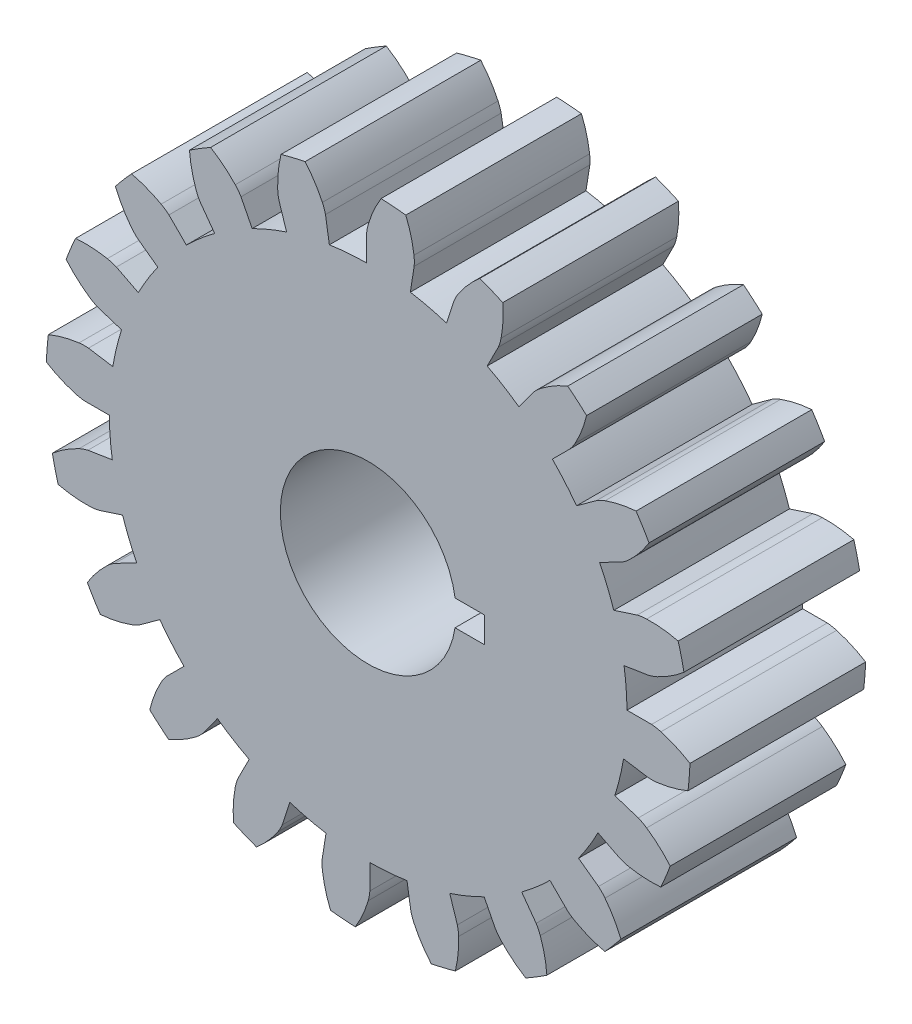
from build123d import *

# Parameters (mm, degrees)
BOSS_EXTRUDE1_DEPTH = 1.5


with BuildPart() as part:
    # Sketch1 → Boss-Extrude1 (new body)
    with BuildSketch(Plane.XY):
        with BuildLine():
            Line((-0.014390692, 2.420326319), (-0.014390692, 2.209953146))
            ThreePointArc((-0.014390692, 2.209953146), (-0.173394602, 2.203187308), (-0.331499319, 2.184996156))
            Line((-0.331499319, 2.184996156), (-0.364408934, 2.392779286))
            ThreePointArc((-0.364408934, 2.392779286), (-0.375758545, 2.431694208), (-0.391086163, 2.469220851))
            ThreePointArc((-0.391086163, 2.469220851), (-0.457119737, 2.587980379), (-0.538570142, 2.696746596))
            ThreePointArc((-0.538570142, 2.696746596), (-0.641974751, 2.674017281), (-0.744427825, 2.647324539))
            ThreePointArc((-0.744427825, 2.647324539), (-0.767621838, 2.51343542), (-0.772542486, 2.377641291))
            ThreePointArc((-0.772542486, 2.377641291), (-0.769162753, 2.337246214), (-0.761608326, 2.297420149))
            Line((-0.761608326, 2.297420149), (-0.69659944, 2.097343372))
            ThreePointArc((-0.69659944, 2.097343372), (-0.845730386, 2.041773767), (-0.990475533, 1.975615909))
            Line((-0.990475533, 1.975615909), (-1.085982955, 2.163059779))
            ThreePointArc((-1.085982955, 2.163059779), (-1.108802449, 2.196562846), (-1.134976249, 2.22751631))
            ThreePointArc((-1.134976249, 2.22751631), (-1.234476622, 2.320057837), (-1.34555117, 2.398331096))
            ThreePointArc((-1.34555117, 2.398331096), (-1.436871053, 2.344760452), (-1.526061206, 2.287714404))
            ThreePointArc((-1.526061206, 2.287714404), (-1.50674601, 2.153210941), (-1.469463131, 2.022542486))
            ThreePointArc((-1.469463131, 2.022542486), (-1.453766049, 1.98516888), (-1.434274431, 1.949626488))
            Line((-1.434274431, 1.949626488), (-1.310620182, 1.779431015))
            ThreePointArc((-1.310620182, 1.779431015), (-1.435280187, 1.680497184), (-1.5524971, 1.572848612))
            Line((-1.5524971, 1.572848612), (-1.701253397, 1.721604909))
            ThreePointArc((-1.701253397, 1.721604909), (-1.733309043, 1.746416608), (-1.767766953, 1.767766953))
            ThreePointArc((-1.767766953, 1.767766953), (-1.890994336, 1.825031868), (-2.020820275, 1.865150239))
            ThreePointArc((-2.020820275, 1.865150239), (-2.091116405, 1.785982133), (-2.158313083, 1.704166845))
            ThreePointArc((-2.158313083, 1.704166845), (-2.098379385, 1.582215173), (-2.022542486, 1.469463131))
            ThreePointArc((-2.022542486, 1.469463131), (-1.996064594, 1.438769384), (-1.966543761, 1.410989802))
            Line((-1.966543761, 1.410989802), (-1.796348288, 1.287335553))
            ThreePointArc((-1.796348288, 1.287335553), (-1.884334763, 1.154721828), (-1.962549434, 1.016119934))
            Line((-1.962549434, 1.016119934), (-2.149993304, 1.111627356))
            ThreePointArc((-2.149993304, 1.111627356), (-2.188147271, 1.125318945), (-2.22751631, 1.134976249))
            ThreePointArc((-2.22751631, 1.134976249), (-2.362408348, 1.151359065), (-2.498277412, 1.149395481))
            ThreePointArc((-2.498277412, 1.149395481), (-2.540668714, 1.052379439), (-2.579294238, 0.95380356))
            ThreePointArc((-2.579294238, 0.95380356), (-2.484608765, 0.85634116), (-2.377641291, 0.772542486))
            ThreePointArc((-2.377641291, 0.772542486), (-2.34297443, 0.751533117), (-2.306314086, 0.734235603))
            Line((-2.306314086, 0.734235603), (-2.106237309, 0.669226718))
            ThreePointArc((-2.106237309, 0.669226718), (-2.148937524, 0.515914254), (-2.180493755, 0.359926357))
            Line((-2.180493755, 0.359926357), (-2.388276886, 0.392835972))
            ThreePointArc((-2.388276886, 0.392835972), (-2.428794399, 0.394067222), (-2.469220851, 0.391086163))
            ThreePointArc((-2.469220851, 0.391086163), (-2.602573371, 0.364983214), (-2.731185749, 0.321129885))
            ThreePointArc((-2.731185749, 0.321129885), (-2.741522668, 0.215762513), (-2.747796102, 0.110075338))
            ThreePointArc((-2.747796102, 0.110075338), (-2.627627328, 0.046642508), (-2.5, 0))
            ThreePointArc((-2.5, 0), (-2.460537604, -0.009268448), (-2.420326319, -0.014390692))
            Line((-2.420326319, -0.014390692), (-2.209953146, -0.014390692))
            ThreePointArc((-2.209953146, -0.014390692), (-2.203187308, -0.173394602), (-2.184996156, -0.331499319))
            Line((-2.184996156, -0.331499319), (-2.392779286, -0.364408934))
            ThreePointArc((-2.392779286, -0.364408934), (-2.431694208, -0.375758545), (-2.469220851, -0.391086163))
            ThreePointArc((-2.469220851, -0.391086163), (-2.587980379, -0.457119737), (-2.696746596, -0.538570142))
            ThreePointArc((-2.696746596, -0.538570142), (-2.674017281, -0.641974751), (-2.647324539, -0.744427825))
            ThreePointArc((-2.647324539, -0.744427825), (-2.51343542, -0.767621838), (-2.377641291, -0.772542486))
            ThreePointArc((-2.377641291, -0.772542486), (-2.337246214, -0.769162753), (-2.297420149, -0.761608326))
            Line((-2.297420149, -0.761608326), (-2.097343372, -0.69659944))
            ThreePointArc((-2.097343372, -0.69659944), (-2.041773767, -0.845730386), (-1.975615909, -0.990475533))
            Line((-1.975615909, -0.990475533), (-2.163059779, -1.085982955))
            ThreePointArc((-2.163059779, -1.085982955), (-2.196562846, -1.108802449), (-2.22751631, -1.134976249))
            ThreePointArc((-2.22751631, -1.134976249), (-2.320057837, -1.234476622), (-2.398331096, -1.34555117))
            ThreePointArc((-2.398331096, -1.34555117), (-2.344760452, -1.436871053), (-2.287714404, -1.526061206))
            ThreePointArc((-2.287714404, -1.526061206), (-2.153210941, -1.50674601), (-2.022542486, -1.469463131))
            ThreePointArc((-2.022542486, -1.469463131), (-1.98516888, -1.453766049), (-1.949626488, -1.434274431))
            Line((-1.949626488, -1.434274431), (-1.779431015, -1.310620182))
            ThreePointArc((-1.779431015, -1.310620182), (-1.680497184, -1.435280187), (-1.572848612, -1.5524971))
            Line((-1.572848612, -1.5524971), (-1.721604909, -1.701253397))
            ThreePointArc((-1.721604909, -1.701253397), (-1.746416608, -1.733309043), (-1.767766953, -1.767766953))
            ThreePointArc((-1.767766953, -1.767766953), (-1.825031868, -1.890994336), (-1.865150239, -2.020820275))
            ThreePointArc((-1.865150239, -2.020820275), (-1.785982133, -2.091116405), (-1.704166845, -2.158313083))
            ThreePointArc((-1.704166845, -2.158313083), (-1.582215173, -2.098379385), (-1.469463131, -2.022542486))
            ThreePointArc((-1.469463131, -2.022542486), (-1.438769384, -1.996064594), (-1.410989802, -1.966543761))
            Line((-1.410989802, -1.966543761), (-1.287335553, -1.796348288))
            ThreePointArc((-1.287335553, -1.796348288), (-1.154721828, -1.884334763), (-1.016119934, -1.962549434))
            Line((-1.016119934, -1.962549434), (-1.111627356, -2.149993304))
            ThreePointArc((-1.111627356, -2.149993304), (-1.125318945, -2.188147271), (-1.134976249, -2.22751631))
            ThreePointArc((-1.134976249, -2.22751631), (-1.151359065, -2.362408348), (-1.149395481, -2.498277412))
            ThreePointArc((-1.149395481, -2.498277412), (-1.052379439, -2.540668714), (-0.95380356, -2.579294238))
            ThreePointArc((-0.95380356, -2.579294238), (-0.85634116, -2.484608765), (-0.772542486, -2.377641291))
            ThreePointArc((-0.772542486, -2.377641291), (-0.751533117, -2.34297443), (-0.734235603, -2.306314086))
            Line((-0.734235603, -2.306314086), (-0.669226718, -2.106237309))
            ThreePointArc((-0.669226718, -2.106237309), (-0.515914254, -2.148937524), (-0.359926357, -2.180493755))
            Line((-0.359926357, -2.180493755), (-0.392835972, -2.388276886))
            ThreePointArc((-0.392835972, -2.388276886), (-0.394067222, -2.428794399), (-0.391086163, -2.469220851))
            ThreePointArc((-0.391086163, -2.469220851), (-0.364983214, -2.602573371), (-0.321129885, -2.731185749))
            ThreePointArc((-0.321129885, -2.731185749), (-0.215762513, -2.741522668), (-0.110075338, -2.747796102))
            ThreePointArc((-0.110075338, -2.747796102), (-0.046642508, -2.627627328), (0, -2.5))
            ThreePointArc((0, -2.5), (0.009268448, -2.460537604), (0.014390692, -2.420326319))
            Line((0.014390692, -2.420326319), (0.014390692, -2.209953146))
            ThreePointArc((0.014390692, -2.209953146), (0.173394602, -2.203187308), (0.331499319, -2.184996156))
            Line((0.331499319, -2.184996156), (0.364408934, -2.392779286))
            ThreePointArc((0.364408934, -2.392779286), (0.375758545, -2.431694208), (0.391086163, -2.469220851))
            ThreePointArc((0.391086163, -2.469220851), (0.457119737, -2.587980379), (0.538570142, -2.696746596))
            ThreePointArc((0.538570142, -2.696746596), (0.641974751, -2.674017281), (0.744427825, -2.647324539))
            ThreePointArc((0.744427825, -2.647324539), (0.767621838, -2.51343542), (0.772542486, -2.377641291))
            ThreePointArc((0.772542486, -2.377641291), (0.769162753, -2.337246214), (0.761608326, -2.297420149))
            Line((0.761608326, -2.297420149), (0.69659944, -2.097343372))
            ThreePointArc((0.69659944, -2.097343372), (0.845730386, -2.041773767), (0.990475533, -1.975615909))
            Line((0.990475533, -1.975615909), (1.085982955, -2.163059779))
            ThreePointArc((1.085982955, -2.163059779), (1.108802449, -2.196562846), (1.134976249, -2.22751631))
            ThreePointArc((1.134976249, -2.22751631), (1.234476622, -2.320057837), (1.34555117, -2.398331096))
            ThreePointArc((1.34555117, -2.398331096), (1.436871053, -2.344760452), (1.526061206, -2.287714404))
            ThreePointArc((1.526061206, -2.287714404), (1.50674601, -2.153210941), (1.469463131, -2.022542486))
            ThreePointArc((1.469463131, -2.022542486), (1.453766049, -1.98516888), (1.434274431, -1.949626488))
            Line((1.434274431, -1.949626488), (1.310620182, -1.779431015))
            ThreePointArc((1.310620182, -1.779431015), (1.435280187, -1.680497184), (1.5524971, -1.572848612))
            Line((1.5524971, -1.572848612), (1.701253397, -1.721604909))
            ThreePointArc((1.701253397, -1.721604909), (1.733309043, -1.746416608), (1.767766953, -1.767766953))
            ThreePointArc((1.767766953, -1.767766953), (1.890994336, -1.825031868), (2.020820275, -1.865150239))
            ThreePointArc((2.020820275, -1.865150239), (2.091116405, -1.785982133), (2.158313083, -1.704166845))
            ThreePointArc((2.158313083, -1.704166845), (2.098379385, -1.582215173), (2.022542486, -1.469463131))
            ThreePointArc((2.022542486, -1.469463131), (1.996064594, -1.438769384), (1.966543761, -1.410989802))
            Line((1.966543761, -1.410989802), (1.796348288, -1.287335553))
            ThreePointArc((1.796348288, -1.287335553), (1.884334763, -1.154721828), (1.962549434, -1.016119934))
            Line((1.962549434, -1.016119934), (2.149993304, -1.111627356))
            ThreePointArc((2.149993304, -1.111627356), (2.188147271, -1.125318945), (2.22751631, -1.134976249))
            ThreePointArc((2.22751631, -1.134976249), (2.362408348, -1.151359065), (2.498277412, -1.149395481))
            ThreePointArc((2.498277412, -1.149395481), (2.540668714, -1.052379439), (2.579294238, -0.95380356))
            ThreePointArc((2.579294238, -0.95380356), (2.484608765, -0.85634116), (2.377641291, -0.772542486))
            ThreePointArc((2.377641291, -0.772542486), (2.34297443, -0.751533117), (2.306314086, -0.734235603))
            Line((2.306314086, -0.734235603), (2.106237309, -0.669226718))
            ThreePointArc((2.106237309, -0.669226718), (2.148937524, -0.515914254), (2.180493755, -0.359926357))
            Line((2.180493755, -0.359926357), (2.388276886, -0.392835972))
            ThreePointArc((2.388276886, -0.392835972), (2.428794399, -0.394067222), (2.469220851, -0.391086163))
            ThreePointArc((2.469220851, -0.391086163), (2.602573371, -0.364983214), (2.731185749, -0.321129885))
            ThreePointArc((2.731185749, -0.321129885), (2.741522668, -0.215762513), (2.747796102, -0.110075338))
            ThreePointArc((2.747796102, -0.110075338), (2.627627328, -0.046642508), (2.5, 0))
            ThreePointArc((2.5, 0), (2.460537604, 0.009268448), (2.420326319, 0.014390692))
            Line((2.420326319, 0.014390692), (2.209953146, 0.014390692))
            ThreePointArc((2.209953146, 0.014390692), (2.203187308, 0.173394602), (2.184996156, 0.331499319))
            Line((2.184996156, 0.331499319), (2.392779286, 0.364408934))
            ThreePointArc((2.392779286, 0.364408934), (2.431694208, 0.375758545), (2.469220851, 0.391086163))
            ThreePointArc((2.469220851, 0.391086163), (2.587980379, 0.457119737), (2.696746596, 0.538570142))
            ThreePointArc((2.696746596, 0.538570142), (2.674017281, 0.641974751), (2.647324539, 0.744427825))
            ThreePointArc((2.647324539, 0.744427825), (2.51343542, 0.767621838), (2.377641291, 0.772542486))
            ThreePointArc((2.377641291, 0.772542486), (2.337246214, 0.769162753), (2.297420149, 0.761608326))
            Line((2.297420149, 0.761608326), (2.097343372, 0.69659944))
            ThreePointArc((2.097343372, 0.69659944), (2.041773767, 0.845730386), (1.975615909, 0.990475533))
            Line((1.975615909, 0.990475533), (2.163059779, 1.085982955))
            ThreePointArc((2.163059779, 1.085982955), (2.196562846, 1.108802449), (2.22751631, 1.134976249))
            ThreePointArc((2.22751631, 1.134976249), (2.320057837, 1.234476622), (2.398331096, 1.34555117))
            ThreePointArc((2.398331096, 1.34555117), (2.344760452, 1.436871053), (2.287714404, 1.526061206))
            ThreePointArc((2.287714404, 1.526061206), (2.153210941, 1.50674601), (2.022542486, 1.469463131))
            ThreePointArc((2.022542486, 1.469463131), (1.98516888, 1.453766049), (1.949626488, 1.434274431))
            Line((1.949626488, 1.434274431), (1.779431015, 1.310620182))
            ThreePointArc((1.779431015, 1.310620182), (1.680497184, 1.435280187), (1.572848612, 1.5524971))
            Line((1.572848612, 1.5524971), (1.721604909, 1.701253397))
            ThreePointArc((1.721604909, 1.701253397), (1.746416608, 1.733309043), (1.767766953, 1.767766953))
            ThreePointArc((1.767766953, 1.767766953), (1.825031868, 1.890994336), (1.865150239, 2.020820275))
            ThreePointArc((1.865150239, 2.020820275), (1.785982133, 2.091116405), (1.704166845, 2.158313083))
            ThreePointArc((1.704166845, 2.158313083), (1.582215173, 2.098379385), (1.469463131, 2.022542486))
            ThreePointArc((1.469463131, 2.022542486), (1.438769384, 1.996064594), (1.410989802, 1.966543761))
            Line((1.410989802, 1.966543761), (1.287335553, 1.796348288))
            ThreePointArc((1.287335553, 1.796348288), (1.154721828, 1.884334763), (1.016119934, 1.962549434))
            Line((1.016119934, 1.962549434), (1.111627356, 2.149993304))
            ThreePointArc((1.111627356, 2.149993304), (1.125318945, 2.188147271), (1.134976249, 2.22751631))
            ThreePointArc((1.134976249, 2.22751631), (1.151359065, 2.362408348), (1.149395481, 2.498277412))
            ThreePointArc((1.149395481, 2.498277412), (1.052379439, 2.540668714), (0.95380356, 2.579294238))
            ThreePointArc((0.95380356, 2.579294238), (0.85634116, 2.484608765), (0.772542486, 2.377641291))
            ThreePointArc((0.772542486, 2.377641291), (0.751533117, 2.34297443), (0.734235603, 2.306314086))
            Line((0.734235603, 2.306314086), (0.669226718, 2.106237309))
            ThreePointArc((0.669226718, 2.106237309), (0.515914254, 2.148937524), (0.359926357, 2.180493755))
            Line((0.359926357, 2.180493755), (0.392835972, 2.388276886))
            ThreePointArc((0.392835972, 2.388276886), (0.394067222, 2.428794399), (0.391086163, 2.469220851))
            ThreePointArc((0.391086163, 2.469220851), (0.364983214, 2.602573371), (0.321129885, 2.731185749))
            ThreePointArc((0.321129885, 2.731185749), (0.215762513, 2.741522668), (0.110075338, 2.747796102))
            ThreePointArc((0.110075338, 2.747796102), (0.046642508, 2.627627328), (0, 2.5))
            ThreePointArc((0, 2.5), (-0.009268448, 2.460537604), (-0.014390692, 2.420326319))
        make_face()
        with BuildLine():
            Line((0.741878305, 0.110075338), (0.991878305, 0.110075338))
            Line((0.991878305, 0.110075338), (0.991878305, -0.110075338))
            Line((0.991878305, -0.110075338), (0.741878305, -0.110075338))
            ThreePointArc((0.741878305, -0.110075338), (-0.75, 0), (0.741878305, 0.110075338))
        make_face(mode=Mode.SUBTRACT)
    extrude(amount=BOSS_EXTRUDE1_DEPTH)


solid = part.part
